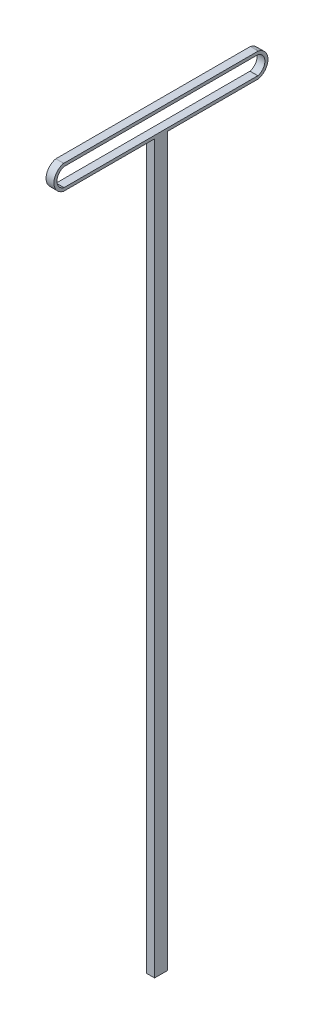
from build123d import *

# Parameters (mm, degrees)
BOSS_EXTRUDE1_DEPTH = 6.5
SKETCH3_W           = 13
SKETCH3_H           = 20.987716218
BOSS_EXTRUDE2_DEPTH = 1200


with BuildPart() as part:
    # Sketch1 → Boss-Extrude1 (new, symmetric)
    with BuildSketch(Plane(origin=(0, 0, 0), x_dir=(0, 0, -1), z_dir=(1, 0, 0))):
        with BuildLine():
            Line((-160.579938889, -20), (160.579938889, -20))
            ThreePointArc((160.579938889, -20), (176.670722942, 0), (160.579938889, 20))
            Line((160.579938889, 20), (-160.579938889, 20))
            ThreePointArc((-160.579938889, 20), (-176.670722942, 0), (-160.579938889, -20))
        make_face()
        with BuildLine():
            Line((-160, 15), (160, 15))
            ThreePointArc((160, 15), (171.670722942, 0), (160, -15))
            Line((160, -15), (-160, -15))
            ThreePointArc((-160, -15), (-171.670722942, 0), (-160, 15))
        make_face(mode=Mode.SUBTRACT)
    extrude(amount=BOSS_EXTRUDE1_DEPTH, both=True)

    # Sketch3 → Boss-Extrude2 (add)
    with BuildSketch(Plane.XZ.offset(20)):
        Rectangle(SKETCH3_W, SKETCH3_H)
    extrude(amount=BOSS_EXTRUDE2_DEPTH)


solid = part.part
